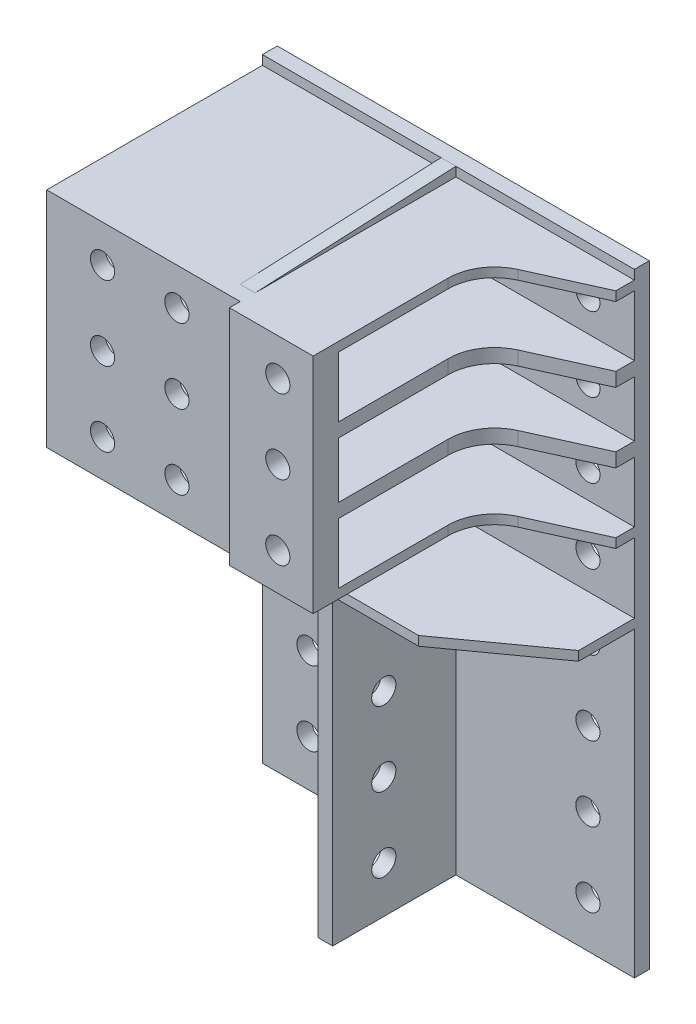
from build123d import *

# Parameters (mm, degrees)
SKETCH_1_W                       = 400
SKETCH_1_H                       = 660
EXTRUDE_1_DEPTH                  = 16
SKETCH_2_R                       = 13
CUT_EXTRUDE_1_DEPTH              = 772.917093994
PATTERN_LINEAR_1_COUNT           = 2
PATTERN_LINEAR_1_PITCH           = 300
PATTERN_LINEAR_1_COUNT_DIR2      = 8
PATTERN_LINEAR_1_PITCH_DIR2      = 80
SKETCH_3_W                       = 16
SKETCH_3_H                       = 660
EXTRUDE_2_DEPTH                  = 216
SKETCH_4_R                       = 13
CUT_EXTRUDE_2_DEPTH              = 730.854780076
SKETCH_5_W                       = 192
SKETCH_5_H                       = 10
EXTRUDE_3_DEPTH                  = 216
CUT_EXTRUDE_3_DEPTH              = 790.572035979
PATTERN_LINEAR_2_COUNT           = 2
PATTERN_LINEAR_2_PITCH           = 75
PATTERN_LINEAR_3_COUNT           = 2
PATTERN_LINEAR_3_PITCH           = 80
PATTERN_LINEAR_3_COPY_1_SKETCH_W = 192
PATTERN_LINEAR_3_COPY_1_SKETCH_H = 10
PATTERN_LINEAR_3_COPY_1_DEPTH    = 216
PATTERN_LINEAR_3_COPY_2_DEPTH    = 790.572035979
PATTERN_LINEAR_3_COPY_3_DEPTH    = 790.572035979
PATTERN_LINEAR_4_COUNT           = 2
PATTERN_LINEAR_4_PITCH           = 75
PATTERN_LINEAR_4_COPY_1_SKETCH_W = 192
PATTERN_LINEAR_4_COPY_1_SKETCH_H = 10
PATTERN_LINEAR_4_COPY_1_DEPTH    = 216
PATTERN_LINEAR_4_COPY_2_DEPTH    = 790.572035979
PATTERN_LINEAR_4_COPY_3_DEPTH    = 790.572035979
PATTERN_LINEAR_4_COPY_4_SKETCH_W = 192
PATTERN_LINEAR_4_COPY_4_SKETCH_H = 10
PATTERN_LINEAR_4_COPY_4_DEPTH    = 216
PATTERN_LINEAR_4_COPY_5_SKETCH_W = 192
PATTERN_LINEAR_4_COPY_5_SKETCH_H = 10
PATTERN_LINEAR_4_COPY_5_DEPTH    = 216
PATTERN_LINEAR_4_COPY_6_DEPTH    = 790.572035979
PATTERN_LINEAR_4_COPY_7_DEPTH    = 790.572035979
PATTERN_LINEAR_4_COPY_8_DEPTH    = 790.572035979
SKETCH_7_W                       = 400
SKETCH_7_H                       = 10
EXTRUDE_4_DEPTH                  = 132
CUT_EXTRUDE_4_DEPTH              = 10
SKETCH_9_W                       = 298
SKETCH_9_H                       = 240
EXTRUDE_5_DEPTH                  = 16
SKETCH_10_R                      = 13
CUT_EXTRUDE_5_DEPTH              = 806.868475621
PATTERN_LINEAR_6_COUNT           = 3
PATTERN_LINEAR_6_PITCH           = 80
PATTERN_LINEAR_7_COUNT           = 2
PATTERN_LINEAR_7_PITCH           = 120
PATTERN_LINEAR_7_COPY_1_SKETCH_R = 13
PATTERN_LINEAR_7_COPY_1_DEPTH    = 806.868475621
PATTERN_LINEAR_7_COPY_2_SKETCH_R = 13
PATTERN_LINEAR_7_COPY_2_DEPTH    = 806.868475621
PATTERN_LINEAR_8_COUNT           = 2
PATTERN_LINEAR_8_PITCH           = 80
PATTERN_LINEAR_8_COPY_1_SKETCH_R = 13
PATTERN_LINEAR_8_COPY_1_DEPTH    = 806.868475621
PATTERN_LINEAR_8_COPY_2_SKETCH_R = 13
PATTERN_LINEAR_8_COPY_2_DEPTH    = 806.868475621
SKETCH_11_W                      = 90
SKETCH_11_H                      = 240
SKETCH_11_R                      = 13
EXTRUDE_6_DEPTH                  = 11.5


with BuildPart() as part:
    # 草图1 → 凸台-拉伸1 (new body)
    with BuildSketch(Plane.XY):
        with Locations((200, 330)):
            Rectangle(SKETCH_1_W, SKETCH_1_H)
    extrude(amount=EXTRUDE_1_DEPTH)

    # 草图2 → 切除-拉伸1 (cut, through all)
    with BuildSketch(Plane.XY.offset(16)):
        with Locations((50, 610)):
            Circle(SKETCH_2_R)
    cut_extrude_1 = extrude(amount=-CUT_EXTRUDE_1_DEPTH, mode=Mode.SUBTRACT)

    # 阵列(线性)1: Cut-Extrude 1 2 × 8
    with Locations(*[(i * PATTERN_LINEAR_1_PITCH, -j * PATTERN_LINEAR_1_PITCH_DIR2, 0) for i in range(PATTERN_LINEAR_1_COUNT) for j in range(PATTERN_LINEAR_1_COUNT_DIR2) if (i, j) != (0, 0)]):
        add(cut_extrude_1, mode=Mode.SUBTRACT)

    # 草图3 → 凸台-拉伸2 (add)
    with BuildSketch(Plane.XY.offset(16)):
        with Locations((200, 330)):
            Rectangle(SKETCH_3_W, SKETCH_3_H)
    extrude(amount=EXTRUDE_2_DEPTH)

    # 草图4 → 切除-拉伸2 (cut, through all)
    with BuildSketch(Plane(origin=(208, 0, 0), x_dir=(0, 0, -1), z_dir=(1, 0, 0))):
        with Locations(Location((-93.5, 50, 0), (0, 0, 90))):
            Circle(SKETCH_4_R)
        with Locations(Location((-93.5, 130, 0), (0, 0, 90))):
            Circle(SKETCH_4_R)
        with Locations(Location((-93.5, 210, 0), (0, 0, 90))):
            Circle(SKETCH_4_R)
        Polygon((-232, 660), (-232, 650), (-16, 660), align=None)
        with BuildLine():
            Line((-232, 410), (-198.5, 410))
            ThreePointArc((-198.5, 410), (-163.144660941, 395.355339059), (-148.5, 360))
            Line((-148.5, 360), (-148.5, 0))
            Line((-148.5, 0), (-232, 0))
            Line((-232, 0), (-232, 410))
        make_face()
    extrude(amount=-CUT_EXTRUDE_2_DEPTH, mode=Mode.SUBTRACT)

    # 草图5 → 凸台-拉伸3 (add)
    with BuildSketch(Plane.XY.offset(16)):
        with Locations((304, 645)):
            Rectangle(SKETCH_5_W, SKETCH_5_H)
        with Locations((96, 645)):
            Rectangle(SKETCH_5_W, SKETCH_5_H)
    extrude_3 = extrude(amount=EXTRUDE_3_DEPTH)

    # 草图6 → 切除-拉伸3 (cut, through all)
    with BuildSketch(Plane.XZ.offset(-640)):
        with BuildLine():
            Line((298, 232), (298, 114.300395022))
            ThreePointArc((298, 114.300395022), (306.001372744, 87.168950007), (327.444612345, 68.721057178))
            Line((327.444612345, 68.721057178), (400, 36))
            Line((400, 36), (400, 232))
            Line((400, 232), (298, 232))
        make_face()
    cut_extrude_3 = extrude(amount=-CUT_EXTRUDE_3_DEPTH, mode=Mode.SUBTRACT)

    # 阵列(线性)2: 凸台-拉伸3, 切除-拉伸3 ×2
    with Locations(*[(0, -i * PATTERN_LINEAR_2_PITCH, 0) for i in range(1, PATTERN_LINEAR_2_COUNT)]):
        add(extrude_3)
        add(cut_extrude_3, mode=Mode.SUBTRACT)

    # 阵列(线性)3: 凸台-拉伸3 ×2
    with Locations(*[(0, -i * PATTERN_LINEAR_3_PITCH, 0) for i in range(1, PATTERN_LINEAR_3_COUNT)]):
        add(extrude_3)

    # 阵列(线性)3 copy 1 sketch → 阵列(线性)3 copy 1 (add)
    with BuildSketch(Plane(origin=(0, -155, 16), x_dir=(1, 0, 0), z_dir=(0, 0, 1))):
        with Locations((304, 645)):
            Rectangle(PATTERN_LINEAR_3_COPY_1_SKETCH_W, PATTERN_LINEAR_3_COPY_1_SKETCH_H)
        with Locations((96, 645)):
            Rectangle(PATTERN_LINEAR_3_COPY_1_SKETCH_W, PATTERN_LINEAR_3_COPY_1_SKETCH_H)
    extrude(amount=PATTERN_LINEAR_3_COPY_1_DEPTH)

    # 阵列(线性)3 copy 2 sketch → 阵列(线性)3 copy 2 (cut, through all)
    with BuildSketch(Plane.XZ.offset(-485)):
        with BuildLine():
            Line((298, 232), (298, 114.300395022))
            ThreePointArc((298, 114.300395022), (306.001372744, 87.168950007), (327.444612345, 68.721057178))
            Line((327.444612345, 68.721057178), (400, 36))
            Line((400, 36), (400, 232))
            Line((400, 232), (298, 232))
        make_face()
    extrude(amount=-PATTERN_LINEAR_3_COPY_2_DEPTH, mode=Mode.SUBTRACT)

    # 阵列(线性)3 copy 3 sketch → 阵列(线性)3 copy 3 (cut, through all)
    with BuildSketch(Plane.XZ.offset(-560)):
        with BuildLine():
            Line((298, 232), (298, 114.300395022))
            ThreePointArc((298, 114.300395022), (306.001372744, 87.168950007), (327.444612345, 68.721057178))
            Line((327.444612345, 68.721057178), (400, 36))
            Line((400, 36), (400, 232))
            Line((400, 232), (298, 232))
        make_face()
    extrude(amount=-PATTERN_LINEAR_3_COPY_3_DEPTH, mode=Mode.SUBTRACT)

    # 阵列(线性)4: 凸台-拉伸3 ×2
    with Locations(*[(0, -i * PATTERN_LINEAR_4_PITCH, 0) for i in range(1, PATTERN_LINEAR_4_COUNT)]):
        add(extrude_3)

    # 阵列(线性)4 copy 1 sketch → 阵列(线性)4 copy 1 (add)
    with BuildSketch(Plane(origin=(0, -150, 16), x_dir=(1, 0, 0), z_dir=(0, 0, 1))):
        with Locations((304, 645)):
            Rectangle(PATTERN_LINEAR_4_COPY_1_SKETCH_W, PATTERN_LINEAR_4_COPY_1_SKETCH_H)
        with Locations((96, 645)):
            Rectangle(PATTERN_LINEAR_4_COPY_1_SKETCH_W, PATTERN_LINEAR_4_COPY_1_SKETCH_H)
    extrude(amount=PATTERN_LINEAR_4_COPY_1_DEPTH)

    # 阵列(线性)4 copy 2 sketch → 阵列(线性)4 copy 2 (cut, through all)
    with BuildSketch(Plane.XZ.offset(-490)):
        with BuildLine():
            Line((298, 232), (298, 114.300395022))
            ThreePointArc((298, 114.300395022), (306.001372744, 87.168950007), (327.444612345, 68.721057178))
            Line((327.444612345, 68.721057178), (400, 36))
            Line((400, 36), (400, 232))
            Line((400, 232), (298, 232))
        make_face()
    extrude(amount=-PATTERN_LINEAR_4_COPY_2_DEPTH, mode=Mode.SUBTRACT)

    # 阵列(线性)4 copy 3 sketch → 阵列(线性)4 copy 3 (cut, through all)
    with BuildSketch(Plane.XZ.offset(-565)):
        with BuildLine():
            Line((298, 232), (298, 114.300395022))
            ThreePointArc((298, 114.300395022), (306.001372744, 87.168950007), (327.444612345, 68.721057178))
            Line((327.444612345, 68.721057178), (400, 36))
            Line((400, 36), (400, 232))
            Line((400, 232), (298, 232))
        make_face()
    extrude(amount=-PATTERN_LINEAR_4_COPY_3_DEPTH, mode=Mode.SUBTRACT)

    # 阵列(线性)4 copy 4 sketch → 阵列(线性)4 copy 4 (add)
    with BuildSketch(Plane(origin=(0, -155, 16), x_dir=(1, 0, 0), z_dir=(0, 0, 1))):
        with Locations((304, 645)):
            Rectangle(PATTERN_LINEAR_4_COPY_4_SKETCH_W, PATTERN_LINEAR_4_COPY_4_SKETCH_H)
        with Locations((96, 645)):
            Rectangle(PATTERN_LINEAR_4_COPY_4_SKETCH_W, PATTERN_LINEAR_4_COPY_4_SKETCH_H)
    extrude(amount=PATTERN_LINEAR_4_COPY_4_DEPTH)

    # 阵列(线性)4 copy 5 sketch → 阵列(线性)4 copy 5 (add)
    with BuildSketch(Plane(origin=(0, -230, 16), x_dir=(1, 0, 0), z_dir=(0, 0, 1))):
        with Locations((304, 645)):
            Rectangle(PATTERN_LINEAR_4_COPY_5_SKETCH_W, PATTERN_LINEAR_4_COPY_5_SKETCH_H)
        with Locations((96, 645)):
            Rectangle(PATTERN_LINEAR_4_COPY_5_SKETCH_W, PATTERN_LINEAR_4_COPY_5_SKETCH_H)
    extrude(amount=PATTERN_LINEAR_4_COPY_5_DEPTH)

    # 阵列(线性)4 copy 6 sketch → 阵列(线性)4 copy 6 (cut, through all)
    with BuildSketch(Plane.XZ.offset(-410)):
        with BuildLine():
            Line((298, 232), (298, 114.300395022))
            ThreePointArc((298, 114.300395022), (306.001372744, 87.168950007), (327.444612345, 68.721057178))
            Line((327.444612345, 68.721057178), (400, 36))
            Line((400, 36), (400, 232))
            Line((400, 232), (298, 232))
        make_face()
    extrude(amount=-PATTERN_LINEAR_4_COPY_6_DEPTH, mode=Mode.SUBTRACT)

    # 阵列(线性)4 copy 7 sketch → 阵列(线性)4 copy 7 (cut, through all)
    with BuildSketch(Plane.XZ.offset(-485)):
        with BuildLine():
            Line((298, 232), (298, 114.300395022))
            ThreePointArc((298, 114.300395022), (306.001372744, 87.168950007), (327.444612345, 68.721057178))
            Line((327.444612345, 68.721057178), (400, 36))
            Line((400, 36), (400, 232))
            Line((400, 232), (298, 232))
        make_face()
    extrude(amount=-PATTERN_LINEAR_4_COPY_7_DEPTH, mode=Mode.SUBTRACT)

    # 阵列(线性)4 copy 8 sketch → 阵列(线性)4 copy 8 (cut, through all)
    with BuildSketch(Plane.XZ.offset(-565)):
        with BuildLine():
            Line((298, 232), (298, 114.300395022))
            ThreePointArc((298, 114.300395022), (306.001372744, 87.168950007), (327.444612345, 68.721057178))
            Line((327.444612345, 68.721057178), (400, 36))
            Line((400, 36), (400, 232))
            Line((400, 232), (298, 232))
        make_face()
    extrude(amount=-PATTERN_LINEAR_4_COPY_8_DEPTH, mode=Mode.SUBTRACT)

    # 草图7 → 凸台-拉伸4 (add)
    with BuildSketch(Plane.XY.offset(16)):
        with Locations((200, 330)):
            Rectangle(SKETCH_7_W, SKETCH_7_H)
    extrude(amount=EXTRUDE_4_DEPTH)

    # 草图8 → 切除-拉伸4 (cut)
    with BuildSketch(Plane(origin=(0, 325, 0), x_dir=(-1, 0, 0), z_dir=(0, -1, 0))):
        Polygon((-400, -148), (-300, -148), (-400, -76), align=None)
        Polygon((0, -148), (-100, -148), (0, -76), align=None)
    extrude(amount=-CUT_EXTRUDE_4_DEPTH, mode=Mode.SUBTRACT)

    # 草图9 → 凸台-拉伸5 (add)
    with BuildSketch(Plane.XY.offset(232)):
        with Locations((149, 530)):
            Rectangle(SKETCH_9_W, SKETCH_9_H)
    extrude(amount=EXTRUDE_5_DEPTH)

    # 草图10 → 切除-拉伸5 (cut, through all)
    with BuildSketch(Plane(origin=(0, 0, 232), x_dir=(-1, 0, 0), z_dir=(0, 0, -1))):
        with Locations((-140, 450)):
            Circle(SKETCH_10_R)
    cut_extrude_5 = extrude(amount=-CUT_EXTRUDE_5_DEPTH, mode=Mode.SUBTRACT)

    # 阵列(线性)6: 切除-拉伸5 ×3
    with Locations(*[(0, i * PATTERN_LINEAR_6_PITCH, 0) for i in range(1, PATTERN_LINEAR_6_COUNT)]):
        add(cut_extrude_5, mode=Mode.SUBTRACT)

    # 阵列(线性)7: 切除-拉伸5 ×2
    with Locations(*[(i * PATTERN_LINEAR_7_PITCH, 0, 0) for i in range(1, PATTERN_LINEAR_7_COUNT)]):
        add(cut_extrude_5, mode=Mode.SUBTRACT)

    # 阵列(线性)7 copy 1 sketch → 阵列(线性)7 copy 1 (cut, through all)
    with BuildSketch(Plane(origin=(120, 80, 232), x_dir=(-1, 0, 0), z_dir=(0, 0, -1))):
        with Locations((-140, 450)):
            Circle(PATTERN_LINEAR_7_COPY_1_SKETCH_R)
    extrude(amount=-PATTERN_LINEAR_7_COPY_1_DEPTH, mode=Mode.SUBTRACT)

    # 阵列(线性)7 copy 2 sketch → 阵列(线性)7 copy 2 (cut, through all)
    with BuildSketch(Plane(origin=(120, 160, 232), x_dir=(-1, 0, 0), z_dir=(0, 0, -1))):
        with Locations((-140, 450)):
            Circle(PATTERN_LINEAR_7_COPY_2_SKETCH_R)
    extrude(amount=-PATTERN_LINEAR_7_COPY_2_DEPTH, mode=Mode.SUBTRACT)

    # 阵列(线性)8: 切除-拉伸5 ×2
    with Locations(*[(-i * PATTERN_LINEAR_8_PITCH, 0, 0) for i in range(1, PATTERN_LINEAR_8_COUNT)]):
        add(cut_extrude_5, mode=Mode.SUBTRACT)

    # 阵列(线性)8 copy 1 sketch → 阵列(线性)8 copy 1 (cut, through all)
    with BuildSketch(Plane(origin=(-80, 80, 232), x_dir=(-1, 0, 0), z_dir=(0, 0, -1))):
        with Locations((-140, 450)):
            Circle(PATTERN_LINEAR_8_COPY_1_SKETCH_R)
    extrude(amount=-PATTERN_LINEAR_8_COPY_1_DEPTH, mode=Mode.SUBTRACT)

    # 阵列(线性)8 copy 2 sketch → 阵列(线性)8 copy 2 (cut, through all)
    with BuildSketch(Plane(origin=(-80, 160, 232), x_dir=(-1, 0, 0), z_dir=(0, 0, -1))):
        with Locations((-140, 450)):
            Circle(PATTERN_LINEAR_8_COPY_2_SKETCH_R)
    extrude(amount=-PATTERN_LINEAR_8_COPY_2_DEPTH, mode=Mode.SUBTRACT)

    # 草图11 → 凸台-拉伸6 (add)
    with BuildSketch(Plane.XY.offset(248)):
        with Locations((253, 530)):
            Rectangle(SKETCH_11_W, SKETCH_11_H)
        with Locations(Location((260, 610, 0), (0, 0, 180))):
            Circle(SKETCH_11_R, mode=Mode.SUBTRACT)
        with Locations(Location((260, 530, 0), (0, 0, 180))):
            Circle(SKETCH_11_R, mode=Mode.SUBTRACT)
        with Locations(Location((260, 450, 0), (0, 0, 180))):
            Circle(SKETCH_11_R, mode=Mode.SUBTRACT)
    extrude(amount=EXTRUDE_6_DEPTH)


solid = part.part
